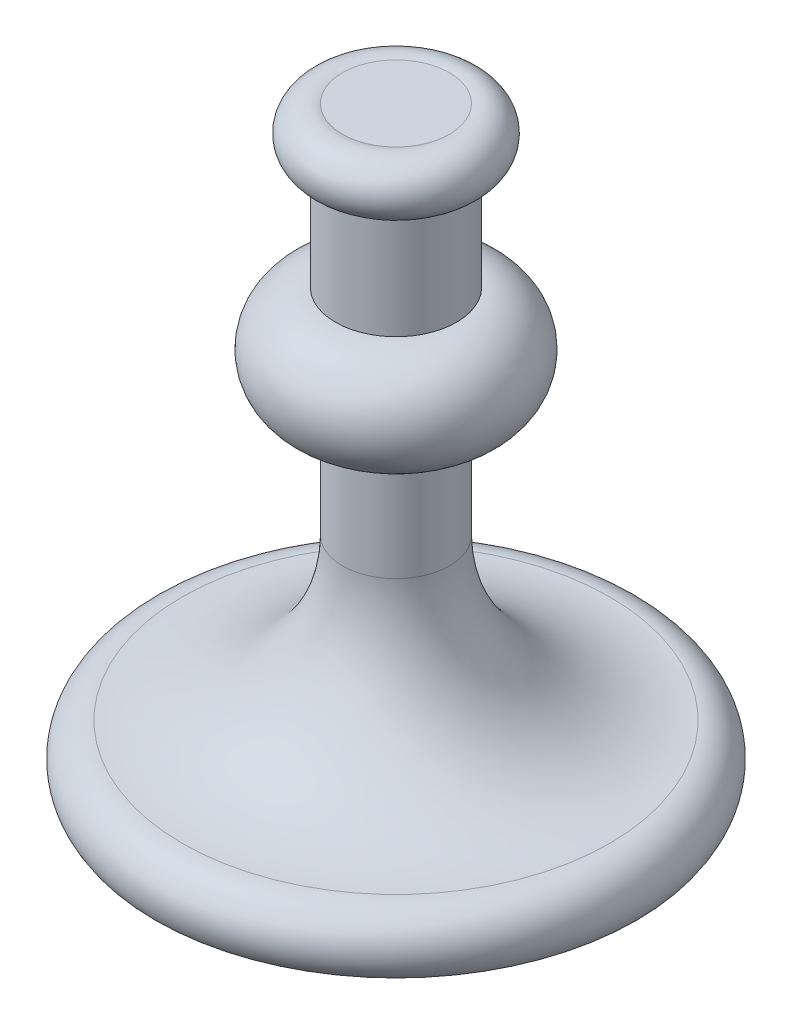
from build123d import *


with BuildPart() as part:
    # Sketch1 → Revolve1 (revolve)
    with BuildSketch(Plane(origin=(0, 0, 0), x_dir=(0, 0, -1), z_dir=(1, 0, 0))):
        with BuildLine():
            Line((-55.061986557, 79.595805047), (-55.061986557, 39.595805047))
            ThreePointArc((-55.061986557, 39.595805047), (-75.016950242, 18.254378823), (-52.385175398, -0.224252521))
            Line((-52.385175398, -0.224252521), (-52.385175398, -40.769119342))
            ThreePointArc((-52.385175398, -40.769119342), (-69.958768526, -83.195526213), (-112.385175398, -100.769119342))
            ThreePointArc((-112.385175398, -100.769119342), (-123.565515285, -107.678949398), (-122.385175398, -120.769119342))
            Line((-122.385175398, -120.769119342), (-32.385175398, -120.769119342))
            Line((-32.385175398, -120.769119342), (-32.385175398, 99.230880658))
            Line((-32.385175398, 99.230880658), (-52.385175398, 99.230880658))
            ThreePointArc((-52.385175398, 99.230880658), (-64.970335463, 90.946590726), (-55.061986557, 79.595805047))
        make_face()
    revolve(axis=Axis((0, 99.230880658, 32.385175398), (0, -1, 0)))


solid = part.part
